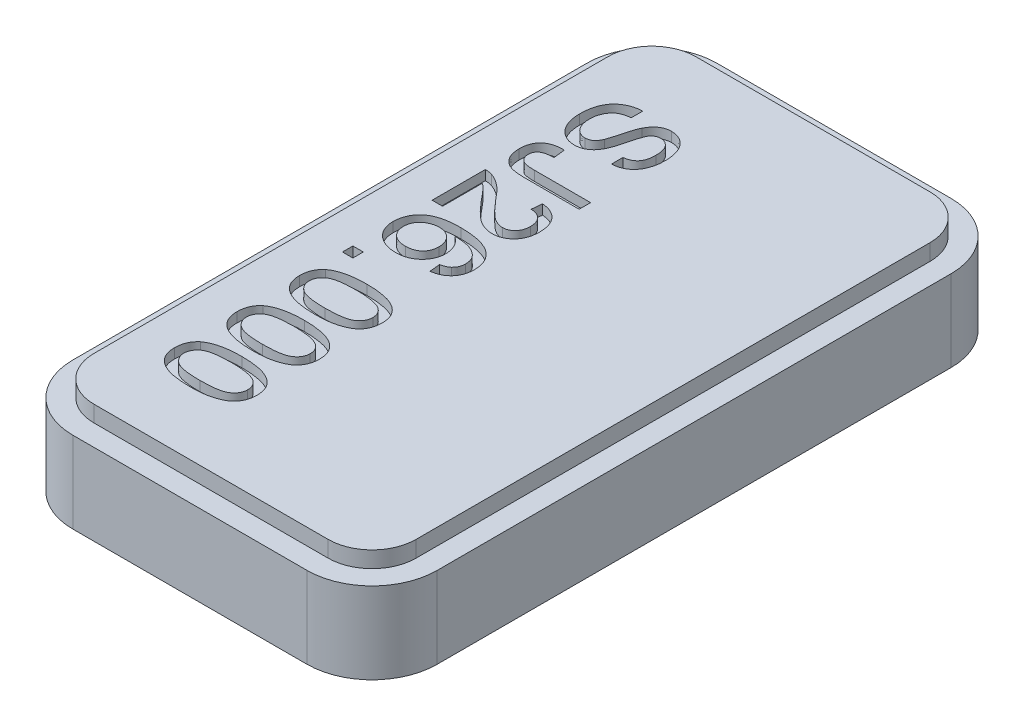
from build123d import *

# Parameters (mm, degrees)
BOSS_EXTRUDE1_DEPTH = 0.635
BOSS_EXTRUDE2_DEPTH = 0.127
SKETCH3_W           = 0.081410256
SKETCH3_H           = 0.081410256
CUT_EXTRUDE1_DEPTH  = 0.0762


with BuildPart() as part:
    # Sketch1 → Boss-Extrude1 (new body)
    with BuildSketch(Plane(origin=(0, 0, 0), x_dir=(1, 0, 0), z_dir=(0, 1, 0))):
        with BuildLine():
            Line((-0.9144, 2.5146), (0.9144, 2.5146))
            ThreePointArc((0.9144, 2.5146), (1.273610245, 2.365810245), (1.4224, 2.0066))
            Line((1.4224, 2.0066), (1.4224, -2.0066))
            ThreePointArc((1.4224, -2.0066), (1.273610245, -2.365810245), (0.9144, -2.5146))
            Line((0.9144, -2.5146), (-0.9144, -2.5146))
            ThreePointArc((-0.9144, -2.5146), (-1.273610245, -2.365810245), (-1.4224, -2.0066))
            Line((-1.4224, -2.0066), (-1.4224, 2.0066))
            ThreePointArc((-1.4224, 2.0066), (-1.273610245, 2.365810245), (-0.9144, 2.5146))
        make_face()
    extrude(amount=BOSS_EXTRUDE1_DEPTH)

    # Sketch2 → Boss-Extrude2 (add)
    with BuildSketch(Plane(origin=(0, 0.635, 0), x_dir=(1, 0, 0), z_dir=(0, 1, 0))):
        with BuildLine():
            Line((-0.9144, 2.3495), (0.9144, 2.3495))
            ThreePointArc((0.9144, 2.3495), (1.156866915, 2.249066915), (1.2573, 2.0066))
            Line((1.2573, 2.0066), (1.2573, -2.0066))
            ThreePointArc((1.2573, -2.0066), (1.156866915, -2.249066915), (0.9144, -2.3495))
            Line((0.9144, -2.3495), (-0.9144, -2.3495))
            ThreePointArc((-0.9144, -2.3495), (-1.156866915, -2.249066915), (-1.2573, -2.0066))
            Line((-1.2573, -2.0066), (-1.2573, 2.0066))
            ThreePointArc((-1.2573, 2.0066), (-1.156866915, 2.249066915), (-0.9144, 2.3495))
        make_face()
    extrude(amount=BOSS_EXTRUDE2_DEPTH)

    # Sketch3 → Cut-Extrude1 (cut)
    # profile 1 of 8: a face of its own
    with BuildSketch(Plane(origin=(0, 0.762, 0), x_dir=(1, 0, 0), z_dir=(0, 1, 0))):
        with BuildLine():
            Line((-0.753424195, 1.77419937), (-0.753424195, 1.684648088))
            add(Edge.make_bspline(
                [(-0.753424195, 1.684648088), (-0.761465428, 1.683664487), (-0.77691307, 1.681774938), (-0.798795669, 1.676465322), (-0.818531337, 1.669712754), (-0.836145432, 1.661012129), (-0.85184619, 1.650050373), (-0.865834799, 1.636561061), (-0.878059324, 1.620230531), (-0.888768656, 1.601730765), (-0.897376534, 1.581253363), (-0.903635748, 1.559357762), (-0.907378215, 1.536160188), (-0.907858461, 1.520272579), (-0.908103682, 1.512160107)],
                knots=[0, 0, 0, 0, 1.125661535, 2.162456423, 3.124646671, 4.021152204, 4.884793578, 5.777140414, 6.711097021, 7.712275503, 8.742730725, 9.791526725, 10.872317486, 12, 12, 12, 12], degree=3))
            add(Edge.make_bspline(
                [(-0.908103682, 1.512160107), (-0.907974474, 1.504981017), (-0.9077233, 1.491025185), (-0.904569176, 1.470784246), (-0.900201049, 1.451725051), (-0.893550475, 1.434195688), (-0.885311828, 1.418389387), (-0.875689223, 1.404491534), (-0.864440247, 1.392850612), (-0.851973105, 1.383477111), (-0.838747254, 1.376195628), (-0.825099494, 1.371120906), (-0.811299567, 1.36770386), (-0.801950678, 1.367332467), (-0.797309411, 1.367148088)],
                knots=[0, 0, 0, 0, 1.267278989, 2.463534024, 3.612003651, 4.716903637, 5.765847919, 6.755281273, 7.693132489, 8.613187884, 9.50174055, 10.350585091, 11.181146174, 12, 12, 12, 12], degree=3))
            add(Edge.make_bspline(
                [(-0.797309411, 1.367148088), (-0.792714401, 1.367344311), (-0.783724232, 1.367728223), (-0.770736874, 1.37071475), (-0.758696129, 1.375657404), (-0.747405304, 1.382455789), (-0.736980476, 1.391805983), (-0.727562824, 1.403746013), (-0.71877468, 1.418220108), (-0.71406796, 1.429071208), (-0.711574235, 1.434820364)],
                knots=[0, 0, 0, 0, 0.942390321, 1.843792698, 2.718029279, 3.604523015, 4.535311134, 5.574971969, 6.71516581, 8, 8, 8, 8], degree=3))
            add(Edge.make_bspline(
                [(-0.711574235, 1.434820364), (-0.710656157, 1.43705749), (-0.708582052, 1.442111566), (-0.705837069, 1.45077424), (-0.702283274, 1.461052425), (-0.69865447, 1.473160521), (-0.694713111, 1.487081279), (-0.690433677, 1.502782774), (-0.685699318, 1.520244651), (-0.68077696, 1.538965206), (-0.675736874, 1.557900939), (-0.670665257, 1.576025784), (-0.665594227, 1.592727675), (-0.660637812, 1.608096487), (-0.655691042, 1.622042887), (-0.650855316, 1.634638472), (-0.646233827, 1.645900496), (-0.642835567, 1.652778873), (-0.641230685, 1.656027295)],
                knots=[0, 0, 0, 0, 0.499203687, 1.127791816, 1.87544445, 2.745218927, 3.737540508, 4.863437871, 6.106074846, 7.473929386, 8.860961239, 10.152791525, 11.360569269, 12.465464948, 13.48744072, 14.416013254, 15.251937243, 16, 16, 16, 16], degree=3))
            add(Edge.make_bspline(
                [(-0.641230685, 1.656027295), (-0.637190668, 1.663498574), (-0.629392384, 1.677920088), (-0.615509121, 1.697343986), (-0.599955346, 1.7135718), (-0.583042344, 1.726827824), (-0.564814356, 1.737147003), (-0.545436237, 1.744344835), (-0.52506706, 1.749090135), (-0.511086053, 1.749545026), (-0.503978081, 1.749776293)],
                knots=[0, 0, 0, 0, 1.158753891, 2.236696577, 3.247844099, 4.216965963, 5.160353944, 6.094570301, 7.031275781, 8, 8, 8, 8], degree=3))
            add(Edge.make_bspline(
                [(-0.503978081, 1.749776293), (-0.496105261, 1.749474873), (-0.480446278, 1.74887535), (-0.457475622, 1.743531118), (-0.435320577, 1.735064474), (-0.417832333, 1.725221907), (-0.404531959, 1.715787486), (-0.39496785, 1.707962203), (-0.386178895, 1.699183349), (-0.377863084, 1.689834968), (-0.370345232, 1.679511738), (-0.363363643, 1.668534976), (-0.357107958, 1.656676466), (-0.349480911, 1.639887564), (-0.341661248, 1.617556853), (-0.334886337, 1.589440629), (-0.330920386, 1.559847153), (-0.330371281, 1.539647979), (-0.330090862, 1.529332583)],
                knots=[0, 0, 0, 0, 1.2001067, 2.387003517, 3.579163215, 4.810460134, 5.437089112, 6.066784591, 6.693680817, 7.331043701, 7.974292474, 8.640345033, 9.314862782, 10.018578828, 11.453312207, 12.917685044, 14.425910937, 16, 16, 16, 16], degree=3))
            add(Edge.make_bspline(
                [(-0.330090862, 1.529332583), (-0.330345906, 1.518041079), (-0.330841576, 1.49609639), (-0.335076583, 1.464159164), (-0.342218456, 1.434350608), (-0.350300088, 1.410946558), (-0.358455149, 1.393670923), (-0.364819817, 1.381398105), (-0.372178175, 1.370006471), (-0.380141086, 1.359393381), (-0.388705148, 1.349460912), (-0.398072837, 1.340461862), (-0.407929187, 1.332014866), (-0.422044212, 1.322064829), (-0.440869628, 1.311572547), (-0.464995315, 1.302011895), (-0.490685438, 1.295958146), (-0.508357, 1.294579323), (-0.517334451, 1.293878857)],
                knots=[0, 0, 0, 0, 1.607767564, 3.124646298, 4.577694013, 5.968230118, 6.64098443, 7.297468537, 7.935727887, 8.569831019, 9.186231226, 9.801209789, 10.418260488, 11.033239051, 12.257996117, 13.47812891, 14.718847046, 16, 16, 16, 16], degree=3))
            Line((-0.517334451, 1.293878857), (-0.517334451, 1.383430139))
            add(Edge.make_bspline(
                [(-0.517334451, 1.383430139), (-0.512782871, 1.383980402), (-0.503867618, 1.385058211), (-0.491055405, 1.388082811), (-0.479019112, 1.391697469), (-0.467903561, 1.396305348), (-0.457607426, 1.401748554), (-0.448333466, 1.408342476), (-0.439723618, 1.415569641), (-0.432015144, 1.423791573), (-0.425243929, 1.433023488), (-0.419378062, 1.443272066), (-0.414419505, 1.454534036), (-0.410359191, 1.466805279), (-0.407210731, 1.480086565), (-0.404894734, 1.494408581), (-0.403708592, 1.509765653), (-0.403478305, 1.520341835), (-0.403360092, 1.525770884)],
                knots=[0, 0, 0, 0, 1.074597235, 2.104830896, 3.08320792, 4.01963776, 4.922947153, 5.808618242, 6.683501764, 7.556007728, 8.44518997, 9.363001905, 10.32032511, 11.326760392, 12.390579697, 13.518793479, 14.726327422, 16, 16, 16, 16], degree=3))
            add(Edge.make_bspline(
                [(-0.403360092, 1.525770884), (-0.403402581, 1.531414147), (-0.403484829, 1.542338116), (-0.404986414, 1.558129631), (-0.407043572, 1.572767482), (-0.410088635, 1.586221385), (-0.414028212, 1.598427462), (-0.418684634, 1.60954837), (-0.424469354, 1.619352589), (-0.430943153, 1.628074325), (-0.43817599, 1.635553214), (-0.44558695, 1.642215739), (-0.453491678, 1.647712076), (-0.461628074, 1.652432427), (-0.470345204, 1.655760202), (-0.479264205, 1.658364728), (-0.488572899, 1.659950127), (-0.494898105, 1.660132117), (-0.498126719, 1.660225011)],
                knots=[0, 0, 0, 0, 1.464643987, 2.835190547, 4.115048982, 5.300866033, 6.411522794, 7.442255218, 8.424145068, 9.359957701, 10.255529779, 11.121374133, 11.943044406, 12.751479056, 13.556984722, 14.358492815, 15.162115312, 16, 16, 16, 16], degree=3))
            add(Edge.make_bspline(
                [(-0.498126719, 1.660225011), (-0.50358998, 1.659993589), (-0.514193666, 1.659544421), (-0.529258306, 1.65495776), (-0.542990703, 1.647903442), (-0.550462429, 1.640953815), (-0.554223474, 1.63745558)],
                knots=[0, 0, 0, 0, 1.050964922, 2.039826012, 3.013306874, 4, 4, 4, 4], degree=3))
            add(Edge.make_bspline(
                [(-0.554223474, 1.63745558), (-0.556103064, 1.63525033), (-0.560259662, 1.630373556), (-0.565760425, 1.621299564), (-0.571318288, 1.610049171), (-0.576843028, 1.59654714), (-0.582402868, 1.580816995), (-0.58812313, 1.562882787), (-0.593834326, 1.542642512), (-0.599246337, 1.520765541), (-0.604812486, 1.498698371), (-0.610265309, 1.477747005), (-0.615461924, 1.45847826), (-0.620525782, 1.440956293), (-0.62544834, 1.425164429), (-0.630331379, 1.411157211), (-0.63482259, 1.398821392), (-0.637982515, 1.391264244), (-0.639449836, 1.387755059)],
                knots=[0, 0, 0, 0, 0.523891657, 1.158554055, 1.913784378, 2.794767528, 3.797522645, 4.933640231, 6.202082727, 7.603978424, 9.013314845, 10.322177672, 11.523239011, 12.626145434, 13.623952425, 14.517289202, 15.3114987, 16, 16, 16, 16], degree=3))
            add(Edge.make_bspline(
                [(-0.639449836, 1.387755059), (-0.641554726, 1.383189307), (-0.645686272, 1.374227501), (-0.652743017, 1.361534007), (-0.660060817, 1.349681682), (-0.667901954, 1.338776038), (-0.676105063, 1.328753334), (-0.684763995, 1.319674576), (-0.693906116, 1.311595944), (-0.706448298, 1.302013174), (-0.723383479, 1.292187669), (-0.74526831, 1.283744208), (-0.768651141, 1.27846299), (-0.784773, 1.277889107), (-0.792984491, 1.277596806)],
                knots=[0, 0, 0, 0, 0.899337291, 1.765248388, 2.59684015, 3.3906421, 4.166844185, 4.912752363, 5.632941945, 6.347675468, 7.734877245, 9.118505574, 10.532342477, 12, 12, 12, 12], degree=3))
            add(Edge.make_bspline(
                [(-0.792984491, 1.277596806), (-0.801283377, 1.2779282), (-0.817759422, 1.278586129), (-0.842045875, 1.284251127), (-0.865579313, 1.293150541), (-0.884254392, 1.303587308), (-0.898519438, 1.313453207), (-0.908772502, 1.321741028), (-0.918253021, 1.330931745), (-0.927258003, 1.340799091), (-0.935603717, 1.351419678), (-0.943293005, 1.362883044), (-0.950405911, 1.375068198), (-0.959073404, 1.392468291), (-0.968140424, 1.415578506), (-0.975691132, 1.44501628), (-0.980589462, 1.476040128), (-0.981108154, 1.497343017), (-0.981372913, 1.508216798)],
                knots=[0, 0, 0, 0, 1.197055466, 2.376552968, 3.581957237, 4.820753935, 5.454298064, 6.085440993, 6.72202542, 7.359198513, 8.013298489, 8.67051481, 9.351020706, 10.049282741, 11.476266879, 12.925760103, 14.430794493, 16, 16, 16, 16], degree=3))
            add(Edge.make_bspline(
                [(-0.981372913, 1.508216798), (-0.981314101, 1.515130436), (-0.981198537, 1.528715588), (-0.979866111, 1.548617623), (-0.977880028, 1.567685129), (-0.974982561, 1.58586835), (-0.97112356, 1.603218539), (-0.96660647, 1.619715997), (-0.961233194, 1.63535924), (-0.955046865, 1.650140377), (-0.947809025, 1.664049643), (-0.940021551, 1.677325034), (-0.931123394, 1.689720705), (-0.921517177, 1.70140489), (-0.911012637, 1.712295667), (-0.899663162, 1.722326325), (-0.887533448, 1.731672747), (-0.874594628, 1.740155914), (-0.860999953, 1.747731393), (-0.846982095, 1.754544704), (-0.832438186, 1.76028481), (-0.817442045, 1.764910843), (-0.802093941, 1.768829312), (-0.786265845, 1.771546684), (-0.770007445, 1.773544586), (-0.758984596, 1.773979819), (-0.753424195, 1.77419937)],
                knots=[0, 0, 0, 0, 1.259794174, 2.475468585, 3.633483936, 4.752716887, 5.828920721, 6.87130154, 7.868357378, 8.841438305, 9.788394823, 10.72402761, 11.64389108, 12.56602382, 13.478685853, 14.398289622, 15.324106125, 16.267144882, 17.215109807, 18.158654996, 19.105737623, 20.061356657, 21.017194371, 21.990367343, 22.986254633, 24, 24, 24, 24], degree=3))
        make_face()
    # profile 2 of 8: a face of its own
    with BuildSketch(Plane(origin=(0, 0.762, 0), x_dir=(1, 0, 0), z_dir=(0, 1, 0))):
        with BuildLine():
            Line((-0.796037376, 1.204327575), (-0.785988298, 1.114776293))
            add(Edge.make_bspline(
                [(-0.785988298, 1.114776293), (-0.791631146, 1.114534341), (-0.802425767, 1.114071493), (-0.817922927, 1.112536974), (-0.832017972, 1.110394825), (-0.844762388, 1.107742115), (-0.85616499, 1.104651754), (-0.866133883, 1.100774425), (-0.87487819, 1.096598444), (-0.88212695, 1.091464446), (-0.888319483, 1.085958523), (-0.893586833, 1.079906475), (-0.898020134, 1.073394854), (-0.901831989, 1.066459394), (-0.904572701, 1.058888312), (-0.906584906, 1.050874857), (-0.907942347, 1.042358207), (-0.908048794, 1.036509203), (-0.908103682, 1.03349324)],
                knots=[0, 0, 0, 0, 1.63255286, 3.123030932, 4.49951906, 5.752042824, 6.885216223, 7.909610261, 8.841530719, 9.678034765, 10.467978015, 11.232499557, 11.990705893, 12.742044187, 13.51390061, 14.310662005, 15.128914839, 16, 16, 16, 16], degree=3))
            add(Edge.make_bspline(
                [(-0.908103682, 1.03349324), (-0.907956203, 1.029108544), (-0.907668029, 1.02054085), (-0.904731082, 1.008243324), (-0.900259283, 0.996782284), (-0.893929628, 0.986401451), (-0.885936593, 0.977337159), (-0.876729381, 0.969514975), (-0.865973371, 0.96361716), (-0.856131862, 0.959716878), (-0.847321175, 0.957387195), (-0.839642526, 0.956090951), (-0.831129568, 0.954761189), (-0.821655493, 0.953823994), (-0.811275994, 0.952846301), (-0.799939416, 0.952460015), (-0.787730244, 0.952007061), (-0.779289493, 0.951973268), (-0.774921591, 0.95195578)],
                knots=[0, 0, 0, 0, 1.177282391, 2.300408846, 3.380386581, 4.475609283, 5.550517805, 6.619299368, 7.707015968, 8.833610655, 9.458733008, 10.154353913, 10.926859838, 11.775644792, 12.714142741, 13.730089572, 14.82537164, 16, 16, 16, 16], degree=3))
            Line((-0.774921591, 0.95195578), (-0.338231887, 0.95195578))
            Line((-0.338231887, 0.95195578), (-0.338231887, 0.862404498))
            Line((-0.338231887, 0.862404498), (-0.769197432, 0.862404498))
            add(Edge.make_bspline(
                [(-0.769197432, 0.862404498), (-0.775643362, 0.862441193), (-0.788117938, 0.862512208), (-0.80628178, 0.863403409), (-0.823330907, 0.864961382), (-0.839309861, 0.866893614), (-0.854151113, 0.869628441), (-0.86789668, 0.872727897), (-0.88053494, 0.876524825), (-0.895641644, 0.882402926), (-0.912836351, 0.891343956), (-0.930875374, 0.905222009), (-0.946520102, 0.921652303), (-0.959222564, 0.940918816), (-0.969114717, 0.962402728), (-0.976212709, 0.985768439), (-0.980665811, 1.010893856), (-0.98113289, 1.028258684), (-0.981372913, 1.037182142)],
                knots=[0, 0, 0, 0, 0.979138624, 1.89489171, 2.761458997, 3.579560347, 4.338878061, 5.052915979, 5.71922422, 6.341219979, 7.513897407, 8.648873756, 9.783411367, 10.9446051, 12.137660755, 13.364187162, 14.645505386, 16, 16, 16, 16], degree=3))
            add(Edge.make_bspline(
                [(-0.981372913, 1.037182142), (-0.981226827, 1.043803524), (-0.980942269, 1.056701228), (-0.978726893, 1.075416717), (-0.975293561, 1.0930205), (-0.969950276, 1.109314378), (-0.963568893, 1.124590734), (-0.955472969, 1.138521307), (-0.94598287, 1.151270324), (-0.934983277, 1.162733339), (-0.922577582, 1.173031057), (-0.908623019, 1.181744515), (-0.89336433, 1.189259813), (-0.876564045, 1.194971611), (-0.858467434, 1.199642866), (-0.838856924, 1.202535523), (-0.817912114, 1.204434522), (-0.803462148, 1.204363875), (-0.796037376, 1.204327575)],
                knots=[0, 0, 0, 0, 1.110296574, 2.162732441, 3.157221742, 4.113121602, 5.033902568, 5.929283926, 6.808331651, 7.693657651, 8.587880195, 9.505359283, 10.446863844, 11.434309352, 12.476166735, 13.577612903, 14.755313945, 16, 16, 16, 16], degree=3))
        make_face()
    # profile 3 of 8: a face of its own
    with BuildSketch(Plane(origin=(0, 0.762, 0), x_dir=(1, 0, 0), z_dir=(0, 1, 0))):
        with BuildLine():
            Line((-0.891821631, 0.349519883), (-0.973231887, 0.349519883))
            Line((-0.973231887, 0.349519883), (-0.973231887, 0.764712191))
            add(Edge.make_bspline(
                [(-0.973231887, 0.764712191), (-0.968393447, 0.764720691), (-0.958732783, 0.764737662), (-0.944445275, 0.763102922), (-0.930347302, 0.760542592), (-0.921306833, 0.757647628), (-0.916753522, 0.756189554)],
                knots=[0, 0, 0, 0, 1.01057331, 2.01775941, 3.001627217, 4, 4, 4, 4], degree=3))
            add(Edge.make_bspline(
                [(-0.916753522, 0.756189554), (-0.909315574, 0.753492886), (-0.894170686, 0.748002025), (-0.87226871, 0.736920018), (-0.85062846, 0.723668541), (-0.83288364, 0.710986591), (-0.818810053, 0.699306499), (-0.80766633, 0.689674698), (-0.796402331, 0.678824668), (-0.784817207, 0.666954202), (-0.772910289, 0.654135338), (-0.760626091, 0.640368575), (-0.748198098, 0.625486124), (-0.739960126, 0.615096831), (-0.735742905, 0.609778296)],
                knots=[0, 0, 0, 0, 1.204749664, 2.453068735, 3.731868309, 5.069624937, 5.772016546, 6.5184395, 7.31363639, 8.154361805, 9.045869205, 9.979533915, 10.965673542, 12, 12, 12, 12], degree=3))
            add(Edge.make_bspline(
                [(-0.735742905, 0.609778296), (-0.728865833, 0.601607684), (-0.715623596, 0.585874652), (-0.695973342, 0.563657145), (-0.677726969, 0.543365069), (-0.66056467, 0.525321552), (-0.64465291, 0.509379017), (-0.630027739, 0.495500031), (-0.616734798, 0.483565174), (-0.60429294, 0.473720148), (-0.592544365, 0.465413598), (-0.581084355, 0.45837453), (-0.56971273, 0.452508401), (-0.558465472, 0.4476227), (-0.547294484, 0.443758526), (-0.536167218, 0.441124542), (-0.525194084, 0.439338265), (-0.517892439, 0.439159546), (-0.514281567, 0.439071165)],
                knots=[0, 0, 0, 0, 1.782554561, 3.432421876, 4.950675607, 6.337395053, 7.588547463, 8.709982106, 9.702713005, 10.569305638, 11.356701089, 12.103210377, 12.812277205, 13.490692607, 14.148717897, 14.782152033, 15.397739362, 16, 16, 16, 16], degree=3))
            add(Edge.make_bspline(
                [(-0.514281567, 0.439071165), (-0.510712825, 0.439159557), (-0.503711149, 0.439332977), (-0.493464239, 0.440978381), (-0.48359622, 0.443268914), (-0.47428474, 0.446972011), (-0.465254038, 0.451379807), (-0.456789518, 0.457033884), (-0.448680048, 0.463574434), (-0.441140105, 0.471063024), (-0.434064424, 0.479241506), (-0.428190195, 0.488382864), (-0.422854403, 0.497906834), (-0.418690525, 0.508128187), (-0.415481549, 0.518955888), (-0.413246009, 0.530372571), (-0.411800706, 0.542408718), (-0.411602495, 0.550624398), (-0.411501118, 0.554826373)],
                knots=[0, 0, 0, 0, 0.988220144, 1.938834179, 2.870816983, 3.789593262, 4.709270892, 5.651202005, 6.603702613, 7.592551374, 8.593130825, 9.593710277, 10.598146602, 11.615084639, 12.644976104, 13.72352976, 14.835681034, 16, 16, 16, 16], degree=3))
            add(Edge.make_bspline(
                [(-0.411501118, 0.554826373), (-0.411602668, 0.559240181), (-0.411801409, 0.567878328), (-0.413242945, 0.580506352), (-0.415458401, 0.59248934), (-0.418788378, 0.603784552), (-0.423147926, 0.614369402), (-0.428344059, 0.624318926), (-0.434502071, 0.63359508), (-0.441654335, 0.642049422), (-0.449445219, 0.649880772), (-0.458254167, 0.656496543), (-0.467617614, 0.662279631), (-0.477832834, 0.666841753), (-0.488675436, 0.670562307), (-0.500306376, 0.673247819), (-0.512675773, 0.674715573), (-0.521146984, 0.675010309), (-0.525475477, 0.675160908)],
                knots=[0, 0, 0, 0, 1.131353863, 2.214142649, 3.254522363, 4.251993147, 5.226998864, 6.184887163, 7.125534989, 8.07474883, 9.020220684, 9.950764588, 10.892228595, 11.83594911, 12.812226535, 13.827427868, 14.889891388, 16, 16, 16, 16], degree=3))
            Line((-0.525475477, 0.675160908), (-0.517334451, 0.756571165))
            add(Edge.make_bspline(
                [(-0.517334451, 0.756571165), (-0.510239286, 0.75573831), (-0.496436253, 0.754118062), (-0.47644592, 0.750080615), (-0.457845326, 0.744418385), (-0.440392924, 0.737622804), (-0.424302207, 0.729165954), (-0.409514477, 0.719361856), (-0.395962163, 0.708218152), (-0.383960439, 0.695540786), (-0.373005835, 0.681814981), (-0.363789181, 0.666700246), (-0.355803082, 0.650547221), (-0.349345584, 0.633240943), (-0.344397685, 0.614788204), (-0.340859909, 0.595217743), (-0.338676546, 0.574507407), (-0.338382222, 0.56030156), (-0.338231887, 0.553045524)],
                knots=[0, 0, 0, 0, 1.130902199, 2.200072888, 3.223843306, 4.206271996, 5.161246612, 6.096017809, 7.01151883, 7.932713564, 8.85544837, 9.78703152, 10.729845199, 11.705020675, 12.706647005, 13.750927778, 14.851223069, 16, 16, 16, 16], degree=3))
            add(Edge.make_bspline(
                [(-0.338231887, 0.553045524), (-0.338357669, 0.545702693), (-0.338602691, 0.531398815), (-0.341108306, 0.510555382), (-0.345013833, 0.490890464), (-0.350446465, 0.472325352), (-0.357621266, 0.454958683), (-0.366262656, 0.438730994), (-0.376519183, 0.42369367), (-0.388345976, 0.410050851), (-0.401262785, 0.397747898), (-0.415054288, 0.386981996), (-0.429608952, 0.377930972), (-0.444884741, 0.370444535), (-0.460980476, 0.364712101), (-0.477835809, 0.360722717), (-0.495409743, 0.357999521), (-0.507401897, 0.35777528), (-0.513518346, 0.357660908)],
                knots=[0, 0, 0, 0, 1.195163465, 2.32818547, 3.412777349, 4.456995471, 5.472468761, 6.467096601, 7.445683341, 8.429710765, 9.401551923, 10.346206623, 11.27346832, 12.187474603, 13.111233882, 14.049000595, 15.004916959, 16, 16, 16, 16], degree=3))
            add(Edge.make_bspline(
                [(-0.513518346, 0.357660908), (-0.519802946, 0.357832599), (-0.532386015, 0.358176358), (-0.551170177, 0.360960358), (-0.569807164, 0.365441754), (-0.588445086, 0.371660034), (-0.607100179, 0.38031391), (-0.626220401, 0.390971844), (-0.64566417, 0.404292813), (-0.662317314, 0.41692561), (-0.676179761, 0.428819719), (-0.687614373, 0.439362419), (-0.699811028, 0.451556702), (-0.713008509, 0.465078289), (-0.72701169, 0.480204127), (-0.742031583, 0.496658583), (-0.757750093, 0.514768471), (-0.768485762, 0.527342698), (-0.774031166, 0.533837791)],
                knots=[0, 0, 0, 0, 0.927016037, 1.85607784, 2.795426669, 3.753038224, 4.749807569, 5.825438141, 6.979408615, 8.224540393, 8.907917664, 9.673913905, 10.518929318, 11.452509573, 12.461825982, 13.560287397, 14.739790317, 16, 16, 16, 16], degree=3))
            add(Edge.make_bspline(
                [(-0.774031166, 0.533837791), (-0.778559042, 0.539399751), (-0.787193005, 0.550005552), (-0.799711287, 0.565093151), (-0.811185383, 0.578611222), (-0.821261529, 0.590857906), (-0.830341422, 0.60141825), (-0.838241066, 0.610518755), (-0.845071575, 0.618069056), (-0.855550478, 0.629579106), (-0.870362333, 0.644268071), (-0.884867818, 0.655004118), (-0.891821631, 0.660150892)],
                knots=[0, 0, 0, 0, 1.24205232, 2.36840259, 3.395101816, 4.312728136, 5.114777656, 5.806942724, 6.399692637, 6.87784234, 8.503262741, 10, 10, 10, 10], degree=3))
            Line((-0.891821631, 0.660150892), (-0.891821631, 0.349519883))
        make_face()
    # profile 4 of 8: a face of its own
    with BuildSketch(Plane(origin=(0, 0.762, 0), x_dir=(1, 0, 0), z_dir=(0, 1, 0))):
        with BuildLine():
            Line((-0.5010524, -0.138941656), (-0.509193426, -0.057531399))
            add(Edge.make_bspline(
                [(-0.509193426, -0.057531399), (-0.502191709, -0.055774631), (-0.489012056, -0.052467786), (-0.471135844, -0.045533363), (-0.45601561, -0.037891777), (-0.447873781, -0.031252899), (-0.444065221, -0.028147385)],
                knots=[0, 0, 0, 0, 1.199207122, 2.257322842, 3.184815751, 4, 4, 4, 4], degree=3))
            add(Edge.make_bspline(
                [(-0.444065221, -0.028147385), (-0.441467574, -0.025481662), (-0.436358603, -0.020238803), (-0.429699023, -0.011631936), (-0.424056694, -0.002558873), (-0.419485551, 0.007007807), (-0.415874611, 0.017016422), (-0.413348566, 0.027508429), (-0.411784801, 0.03846006), (-0.411596484, 0.045922228), (-0.411501118, 0.049701173)],
                knots=[0, 0, 0, 0, 1.028360939, 2.022547923, 3.001693811, 3.976902288, 4.948369586, 5.937776631, 6.955661634, 8, 8, 8, 8], degree=3))
            add(Edge.make_bspline(
                [(-0.411501118, 0.049701173), (-0.411698378, 0.055827493), (-0.412088155, 0.067932834), (-0.415904042, 0.085693532), (-0.421615125, 0.102944163), (-0.427404486, 0.113631567), (-0.43032724, 0.119027094)],
                knots=[0, 0, 0, 0, 1.010336883, 1.996381556, 2.988474728, 4, 4, 4, 4], degree=3))
            add(Edge.make_bspline(
                [(-0.43032724, 0.119027094), (-0.434725111, 0.124330817), (-0.443752889, 0.13521809), (-0.460384796, 0.149457365), (-0.479884737, 0.161994296), (-0.497955041, 0.171424224), (-0.514239957, 0.177964455), (-0.528115997, 0.182436137), (-0.543535084, 0.186024354), (-0.560347148, 0.189079713), (-0.578610948, 0.191423334), (-0.598328292, 0.193388303), (-0.619552098, 0.194473722), (-0.634191035, 0.194715648), (-0.641739499, 0.194840396)],
                knots=[0, 0, 0, 0, 1.063450586, 2.183009608, 3.366294357, 4.641264713, 5.326401404, 6.07664488, 6.892063598, 7.77129542, 8.7166684, 9.737191916, 10.833199044, 12, 12, 12, 12], degree=3))
            add(Edge.make_bspline(
                [(-0.641739499, 0.194840396), (-0.634998127, 0.190039118), (-0.62180148, 0.180640325), (-0.604481578, 0.164065204), (-0.589973064, 0.145854062), (-0.57826799, 0.126207277), (-0.569274795, 0.105558884), (-0.5627236, 0.084367562), (-0.558759564, 0.062612389), (-0.558280795, 0.047936547), (-0.55803958, 0.040542519)],
                knots=[0, 0, 0, 0, 1.084049016, 2.12209208, 3.130949879, 4.128207417, 5.11149915, 6.076901555, 7.031098562, 8, 8, 8, 8], degree=3))
            add(Edge.make_bspline(
                [(-0.55803958, 0.040542519), (-0.558210405, 0.034173904), (-0.558547903, 0.021591495), (-0.561238013, 0.00306605), (-0.565892311, -0.014669709), (-0.572101247, -0.031780898), (-0.580341068, -0.048041109), (-0.590142785, -0.063726337), (-0.602004702, -0.078488168), (-0.615343669, -0.092524127), (-0.630170663, -0.105304531), (-0.646129515, -0.116615775), (-0.66325754, -0.126041919), (-0.681440279, -0.133685411), (-0.700611502, -0.139667784), (-0.720825667, -0.144014687), (-0.742122722, -0.146559307), (-0.756682241, -0.146905886), (-0.764109291, -0.147082681)],
                knots=[0, 0, 0, 0, 0.981571796, 1.939281725, 2.877861438, 3.804367779, 4.739823863, 5.68285443, 6.650639019, 7.653910388, 8.664247958, 9.663507932, 10.664113941, 11.671783641, 12.699293534, 13.755733966, 14.85516306, 16, 16, 16, 16], degree=3))
            add(Edge.make_bspline(
                [(-0.764109291, -0.147082681), (-0.773923871, -0.14676421), (-0.793292708, -0.146135714), (-0.821830518, -0.141143099), (-0.849264435, -0.132969399), (-0.871185447, -0.123590158), (-0.887697162, -0.11443633), (-0.899478666, -0.107084455), (-0.910441676, -0.098994549), (-0.920783795, -0.0904309), (-0.930162525, -0.081020103), (-0.939040523, -0.07130196), (-0.946900006, -0.060736753), (-0.954188088, -0.049752707), (-0.960492831, -0.038125254), (-0.966137678, -0.026178849), (-0.970855612, -0.013802649), (-0.974639285, -0.001029794), (-0.977736942, 0.012082421), (-0.979872442, 0.025602458), (-0.98118805, 0.039498329), (-0.981310815, 0.048892589), (-0.981372913, 0.053644482)],
                knots=[0, 0, 0, 0, 1.777725645, 3.508298892, 5.231915806, 6.956149154, 7.815891424, 8.651536337, 9.470662572, 10.283276216, 11.081966684, 11.876395462, 12.66627801, 13.465448804, 14.263251756, 15.060721634, 15.858413576, 16.660607494, 17.473221138, 18.298093177, 19.139125428, 20, 20, 20, 20], degree=3))
            add(Edge.make_bspline(
                [(-0.981372913, 0.053644482), (-0.981149817, 0.061669334), (-0.980712287, 0.07740748), (-0.977367223, 0.100446397), (-0.971725488, 0.122346724), (-0.963989177, 0.143146606), (-0.953991182, 0.162801101), (-0.941641977, 0.181242039), (-0.927094376, 0.198548784), (-0.910340963, 0.214745792), (-0.89093877, 0.22937758), (-0.868707146, 0.242133172), (-0.843461534, 0.252581321), (-0.815516988, 0.261406052), (-0.784609146, 0.267939691), (-0.750937652, 0.27297855), (-0.714372732, 0.275628849), (-0.689062898, 0.27603852), (-0.675957248, 0.276250652)],
                knots=[0, 0, 0, 0, 0.898449204, 1.762016875, 2.600428026, 3.426826527, 4.242280324, 5.064055083, 5.906691075, 6.769749479, 7.668135943, 8.621070442, 9.631748766, 10.722023185, 11.898351526, 13.165512303, 14.532277789, 16, 16, 16, 16], degree=3))
            add(Edge.make_bspline(
                [(-0.675957248, 0.276250652), (-0.668494191, 0.276199478), (-0.653776101, 0.276098556), (-0.632096366, 0.275371679), (-0.611188458, 0.273938445), (-0.591079639, 0.272054578), (-0.57173772, 0.269627308), (-0.553175235, 0.266778088), (-0.535418165, 0.263142901), (-0.518427283, 0.259143141), (-0.502190921, 0.254503119), (-0.486688601, 0.249516847), (-0.472033903, 0.243729812), (-0.45813804, 0.237518627), (-0.445021373, 0.230759804), (-0.432633483, 0.223564356), (-0.421133278, 0.215610399), (-0.413930091, 0.209890044), (-0.410356286, 0.207051934)],
                knots=[0, 0, 0, 0, 1.280444348, 2.525197649, 3.720942618, 4.875526429, 5.989898656, 7.065115415, 8.096622082, 9.098853712, 10.059152529, 10.993162051, 11.891531392, 12.760921141, 13.603603485, 14.422073071, 15.217123906, 16, 16, 16, 16], degree=3))
            add(Edge.make_bspline(
                [(-0.410356286, 0.207051934), (-0.404588124, 0.20192378), (-0.393218539, 0.191815713), (-0.378531729, 0.174523989), (-0.365986934, 0.156098199), (-0.355851826, 0.136244476), (-0.34795017, 0.115114563), (-0.342214268, 0.092695212), (-0.338887841, 0.068923864), (-0.338454082, 0.052679759), (-0.338231887, 0.044358625)],
                knots=[0, 0, 0, 0, 1.005002357, 1.980952959, 2.948226316, 3.90482984, 4.879026092, 5.883055346, 6.915583142, 8, 8, 8, 8], degree=3))
            add(Edge.make_bspline(
                [(-0.338231887, 0.044358625), (-0.338341414, 0.038162616), (-0.338556587, 0.025990059), (-0.340621196, 0.008154155), (-0.34407188, -0.008810924), (-0.348726467, -0.024942964), (-0.354922316, -0.04014816), (-0.362265069, -0.054601811), (-0.371097939, -0.068157152), (-0.381300249, -0.080716049), (-0.392582792, -0.092309609), (-0.405040314, -0.1026938), (-0.41851755, -0.111829494), (-0.43304253, -0.119788134), (-0.448546498, -0.126498602), (-0.465096089, -0.13200823), (-0.482687048, -0.136195915), (-0.49484576, -0.138013722), (-0.5010524, -0.138941656)],
                knots=[0, 0, 0, 0, 1.095988384, 2.15315746, 3.171326302, 4.156539379, 5.119213808, 6.072133135, 7.021027441, 7.975952916, 8.930907862, 9.879001051, 10.840359051, 11.807350428, 12.805278655, 13.825435679, 14.889953203, 16, 16, 16, 16], degree=3))
        make_face()
        with BuildLine():
            add(Edge.make_bspline(
                [(-0.762455645, 0.194840396), (-0.768830031, 0.194613956), (-0.78149512, 0.19416405), (-0.800294271, 0.190722782), (-0.818636271, 0.185102948), (-0.836317413, 0.177400901), (-0.852744988, 0.167890292), (-0.867300953, 0.156593905), (-0.87977159, 0.143756939), (-0.890183961, 0.129448384), (-0.898185581, 0.113701826), (-0.903980834, 0.096799289), (-0.907483504, 0.078720579), (-0.907893834, 0.066253368), (-0.908103682, 0.059877455)],
                knots=[0, 0, 0, 0, 1.034121613, 2.054667162, 3.090870403, 4.141799978, 5.178094622, 6.163726224, 7.122467907, 8.07367165, 9.024701118, 9.977919151, 10.965878387, 12, 12, 12, 12], degree=3))
            add(Edge.make_bspline(
                [(-0.908103682, 0.059877455), (-0.907981355, 0.055333677), (-0.907742583, 0.046464625), (-0.905876228, 0.033482509), (-0.903055434, 0.021121252), (-0.898738168, 0.009438883), (-0.893453338, -0.001645963), (-0.886847651, -0.012078097), (-0.87910628, -0.021860356), (-0.870180487, -0.030887201), (-0.860256143, -0.03904659), (-0.849390944, -0.046135733), (-0.837764524, -0.052396187), (-0.825090929, -0.057105029), (-0.811694908, -0.060942059), (-0.79744978, -0.063763007), (-0.782339194, -0.065419201), (-0.771957694, -0.065586794), (-0.766653362, -0.065672425)],
                knots=[0, 0, 0, 0, 1.023462019, 1.997707343, 2.950204755, 3.875082018, 4.798131411, 5.712685617, 6.65128003, 7.603921197, 8.567945975, 9.540503156, 10.523517238, 11.53671457, 12.580096959, 13.661292135, 14.805058716, 16, 16, 16, 16], degree=3))
            add(Edge.make_bspline(
                [(-0.766653362, -0.065672425), (-0.761559729, -0.065592928), (-0.751598487, -0.065437463), (-0.737062244, -0.063690873), (-0.723322861, -0.061141212), (-0.710484476, -0.057246066), (-0.698470316, -0.05240995), (-0.687203725, -0.046581328), (-0.676821018, -0.039543221), (-0.667434048, -0.031345672), (-0.658897755, -0.022359487), (-0.6514292, -0.012483823), (-0.645238997, -0.001769901), (-0.640064822, 0.00967501), (-0.63613985, 0.021931076), (-0.633412225, 0.034979807), (-0.631510352, 0.048755207), (-0.631377021, 0.058217018), (-0.63130881, 0.063057543)],
                knots=[0, 0, 0, 0, 1.155383407, 2.259498055, 3.31823029, 4.322885379, 5.298549415, 6.25407473, 7.196229935, 8.137696897, 9.077096105, 10.004740892, 10.940535275, 11.8794908, 12.850254721, 13.854356636, 14.902319961, 16, 16, 16, 16], degree=3))
            add(Edge.make_bspline(
                [(-0.63130881, 0.063057543), (-0.631379095, 0.067559294), (-0.631517599, 0.076430422), (-0.633435658, 0.089439462), (-0.636163883, 0.101979631), (-0.640146805, 0.113991025), (-0.645212045, 0.125480378), (-0.651566021, 0.136377823), (-0.658896476, 0.146830633), (-0.667452426, 0.156557767), (-0.676725944, 0.165562808), (-0.686886689, 0.173406262), (-0.697741903, 0.180010088), (-0.709287235, 0.185596508), (-0.721612174, 0.189726209), (-0.734614592, 0.19265273), (-0.748284923, 0.194470055), (-0.75765858, 0.194715028), (-0.762455645, 0.194840396)],
                knots=[0, 0, 0, 0, 1.037172838, 2.043847658, 3.025909439, 3.99370322, 4.956694024, 5.916004533, 6.898066313, 7.896061507, 8.898787354, 9.874696845, 10.848988603, 11.824261125, 12.826080801, 13.838909816, 14.894039933, 16, 16, 16, 16], degree=3))
        make_face(mode=Mode.SUBTRACT)
    # profile 5 of 8: a face of its own
    with BuildSketch(Plane(origin=(0, 0.762, 0), x_dir=(1, 0, 0), z_dir=(0, 1, 0))):
        with Locations((-0.932526759, -0.309903194)):
            Rectangle(SKETCH3_W, SKETCH3_H)
    # profile 6 of 8: a face of its own
    with BuildSketch(Plane(origin=(0, 0.762, 0), x_dir=(1, 0, 0), z_dir=(0, 1, 0))):
        with BuildLine():
            add(Edge.make_bspline(
                [(-0.660056807, -0.472723707), (-0.650982074, -0.472805728), (-0.633208494, -0.472966372), (-0.607202553, -0.473962796), (-0.582505789, -0.475702475), (-0.559139642, -0.478299323), (-0.537051403, -0.481374523), (-0.516272477, -0.485372144), (-0.496756645, -0.489870571), (-0.478522866, -0.495266047), (-0.461419161, -0.501200113), (-0.445456288, -0.507910702), (-0.430728667, -0.51552738), (-0.416836339, -0.523363323), (-0.404430057, -0.532486365), (-0.392724009, -0.541738227), (-0.382386402, -0.552065148), (-0.373078862, -0.562975973), (-0.364868091, -0.574651529), (-0.35778251, -0.587024754), (-0.351526639, -0.600049446), (-0.346817176, -0.61397346), (-0.342977978, -0.628507839), (-0.340153814, -0.643764433), (-0.338488875, -0.659760062), (-0.338318518, -0.670690826), (-0.338231887, -0.676249348)],
                knots=[0, 0, 0, 0, 1.514715004, 2.966688829, 4.343277319, 5.646155648, 6.890271291, 8.064567311, 9.176982507, 10.231801866, 11.236819303, 12.197732759, 13.118802951, 14.00370591, 14.856056722, 15.686168072, 16.491905873, 17.290274347, 18.077650358, 18.870352107, 19.668187111, 20.485160842, 21.319455353, 22.17593919, 23.072426909, 24, 24, 24, 24], degree=3))
            add(Edge.make_bspline(
                [(-0.338231887, -0.676249348), (-0.338471855, -0.684404277), (-0.338943281, -0.700424962), (-0.342781676, -0.723817733), (-0.34936408, -0.745854443), (-0.358174722, -0.766531642), (-0.369571983, -0.785402229), (-0.383070708, -0.802462994), (-0.39923606, -0.817024609), (-0.417537546, -0.829568081), (-0.438011494, -0.840324109), (-0.460465099, -0.849945816), (-0.484993542, -0.858572573), (-0.506887736, -0.864886984), (-0.525819595, -0.869313945), (-0.54146358, -0.872009203), (-0.558291706, -0.874497708), (-0.576344272, -0.876261594), (-0.595536904, -0.878056491), (-0.61595329, -0.878942654), (-0.637579568, -0.879618926), (-0.652423935, -0.879721993), (-0.660056807, -0.879774989)],
                knots=[0, 0, 0, 0, 1.134508601, 2.228787654, 3.287419779, 4.328790846, 5.347871456, 6.346850563, 7.345149742, 8.363256079, 9.427154287, 10.558404831, 11.760335901, 13.043439251, 13.7276639, 14.464993199, 15.251939769, 16.09452972, 16.988861801, 17.934185368, 18.937772297, 20, 20, 20, 20], degree=3))
            add(Edge.make_bspline(
                [(-0.660056807, -0.879774989), (-0.669088986, -0.879691894), (-0.686735125, -0.879529552), (-0.712531552, -0.878553403), (-0.737045479, -0.876731513), (-0.760306801, -0.874383741), (-0.782337088, -0.871222762), (-0.803082426, -0.867271903), (-0.822568259, -0.862708654), (-0.84081424, -0.857544714), (-0.85784548, -0.851536844), (-0.873743486, -0.844760761), (-0.888664036, -0.837494798), (-0.902329246, -0.829253222), (-0.914965329, -0.820475454), (-0.926612064, -0.811079486), (-0.937103919, -0.800870697), (-0.94638088, -0.789858028), (-0.954739302, -0.77826582), (-0.961889311, -0.765860439), (-0.967854211, -0.752670909), (-0.972839608, -0.738814778), (-0.976628407, -0.724200079), (-0.979441489, -0.708902959), (-0.981121711, -0.69282362), (-0.981288024, -0.68185033), (-0.981372913, -0.676249348)],
                knots=[0, 0, 0, 0, 1.50892112, 2.947974422, 4.311604492, 5.614840882, 6.853004102, 8.028299315, 9.14166105, 10.195403725, 11.194594867, 12.156325951, 13.08133133, 13.964490992, 14.819271038, 15.650088719, 16.461567135, 17.260614929, 18.05275699, 18.846133239, 19.648095618, 20.468123593, 21.303127994, 22.167306962, 23.06455749, 24, 24, 24, 24], degree=3))
            add(Edge.make_bspline(
                [(-0.981372913, -0.676249348), (-0.981163443, -0.668905975), (-0.980755034, -0.65458842), (-0.977980146, -0.633678687), (-0.973096213, -0.614053787), (-0.966546171, -0.595548195), (-0.957785112, -0.57836992), (-0.947125573, -0.562436941), (-0.93481556, -0.547429098), (-0.925103242, -0.538789671), (-0.920188017, -0.534417417)],
                knots=[0, 0, 0, 0, 1.10322584, 2.150986741, 3.161425019, 4.136713905, 5.093944212, 6.049774532, 7.013026876, 8, 8, 8, 8], degree=3))
            add(Edge.make_bspline(
                [(-0.920188017, -0.534417417), (-0.912928468, -0.529384851), (-0.897958966, -0.519007486), (-0.872434576, -0.506861679), (-0.844335807, -0.496027405), (-0.813111363, -0.487524486), (-0.779009757, -0.48086458), (-0.741964073, -0.476054466), (-0.701990317, -0.473332415), (-0.674350185, -0.47293119), (-0.660056807, -0.472723707)],
                knots=[0, 0, 0, 0, 0.779365345, 1.607084704, 2.489375761, 3.438383567, 4.461919411, 5.557722155, 6.737039282, 8, 8, 8, 8], degree=3))
        make_face()
        with BuildLine():
            add(Edge.make_bspline(
                [(-0.6598024, -0.554133963), (-0.67201576, -0.554214797), (-0.695394832, -0.554369531), (-0.728795869, -0.555986126), (-0.758928165, -0.558769027), (-0.785749997, -0.562448204), (-0.809297649, -0.567306207), (-0.829511114, -0.573406004), (-0.846632998, -0.580281927), (-0.86045109, -0.588790751), (-0.871714851, -0.598106973), (-0.88140205, -0.607725336), (-0.889635947, -0.617872126), (-0.896501337, -0.628481137), (-0.90169936, -0.639716975), (-0.905466899, -0.651456779), (-0.907635059, -0.663703102), (-0.907946583, -0.672043404), (-0.908103682, -0.676249348)],
                knots=[0, 0, 0, 0, 1.89448813, 3.626469325, 5.185477471, 6.587276848, 7.82441448, 8.910550357, 9.859733512, 10.6775885, 11.416198291, 12.123144072, 12.791880183, 13.439617036, 14.078171869, 14.70637855, 15.347637704, 16, 16, 16, 16], degree=3))
            add(Edge.make_bspline(
                [(-0.908103682, -0.676249348), (-0.907943151, -0.680454238), (-0.90762482, -0.688792452), (-0.905504469, -0.701067072), (-0.901542981, -0.712761198), (-0.896363317, -0.723980284), (-0.889654409, -0.734666404), (-0.881389411, -0.744763361), (-0.871707964, -0.754432391), (-0.860313283, -0.763706765), (-0.846431305, -0.772150764), (-0.829323368, -0.77915567), (-0.809074504, -0.785160406), (-0.785538849, -0.790045066), (-0.758759424, -0.79373942), (-0.728710702, -0.796505495), (-0.69535264, -0.798132908), (-0.672015815, -0.798285088), (-0.6598024, -0.798364733)],
                knots=[0, 0, 0, 0, 0.652509534, 1.29391342, 1.924290653, 2.562989607, 3.207355802, 3.876242846, 4.583348185, 5.32723334, 6.150888545, 7.094226006, 8.186903555, 9.424320409, 10.81992305, 12.379283064, 14.105084285, 16, 16, 16, 16], degree=3))
            add(Edge.make_bspline(
                [(-0.6598024, -0.798364733), (-0.647843106, -0.798287639), (-0.624929551, -0.798139932), (-0.592171998, -0.796470533), (-0.562545419, -0.793854496), (-0.536022733, -0.790275982), (-0.512631997, -0.785520741), (-0.492325715, -0.779751454), (-0.475140106, -0.772882085), (-0.460924428, -0.764697183), (-0.449189857, -0.755622027), (-0.439230647, -0.745979906), (-0.430503058, -0.735957415), (-0.423669175, -0.724981812), (-0.418064406, -0.713519685), (-0.414312391, -0.701325323), (-0.411904377, -0.68855618), (-0.411637504, -0.679822351), (-0.411501118, -0.675358923)],
                knots=[0, 0, 0, 0, 1.850145643, 3.544809038, 5.072983816, 6.450691362, 7.683229814, 8.76276662, 9.712991103, 10.538891656, 11.292051756, 12.001912283, 12.681449089, 13.342071824, 13.996410874, 14.649960216, 15.310061595, 16, 16, 16, 16], degree=3))
            add(Edge.make_bspline(
                [(-0.411501118, -0.675358923), (-0.411611501, -0.671153244), (-0.411829161, -0.662860183), (-0.413906724, -0.650718055), (-0.417380874, -0.639211104), (-0.422086946, -0.628207496), (-0.428420391, -0.61798193), (-0.435815138, -0.608128887), (-0.444824812, -0.599109844), (-0.451560303, -0.593675048), (-0.455004724, -0.590895782)],
                knots=[0, 0, 0, 0, 1.021318143, 2.013908504, 2.982026795, 3.937174072, 4.91255697, 5.897578595, 6.924855925, 8, 8, 8, 8], degree=3))
            add(Edge.make_bspline(
                [(-0.455004724, -0.590895782), (-0.460063511, -0.587870009), (-0.470746604, -0.581480214), (-0.48931426, -0.574330404), (-0.510533557, -0.568014545), (-0.534730969, -0.562814499), (-0.561864987, -0.55905263), (-0.5919041, -0.556082781), (-0.624890248, -0.554540054), (-0.647843937, -0.554273062), (-0.6598024, -0.554133963)],
                knots=[0, 0, 0, 0, 0.671104906, 1.417232262, 2.260109084, 3.195198885, 4.23592645, 5.382417421, 6.636286093, 8, 8, 8, 8], degree=3))
        make_face(mode=Mode.SUBTRACT)
    # profile 7 of 8: a face of its own
    with BuildSketch(Plane(origin=(0, 0.762, 0), x_dir=(1, 0, 0), z_dir=(0, 1, 0))):
        with BuildLine():
            add(Edge.make_bspline(
                [(-0.660056807, -0.961185245), (-0.650982074, -0.961267266), (-0.633208494, -0.961427911), (-0.607202553, -0.962424334), (-0.582505789, -0.964164013), (-0.559139642, -0.966760862), (-0.537051403, -0.969836061), (-0.516272477, -0.973833682), (-0.496756645, -0.978332109), (-0.478522866, -0.983727585), (-0.461419161, -0.989661651), (-0.445456288, -0.99637224), (-0.430728667, -1.003988919), (-0.416836339, -1.011824862), (-0.404430057, -1.020947904), (-0.392724009, -1.030199766), (-0.382386402, -1.040526687), (-0.373078862, -1.051437512), (-0.364868091, -1.063113067), (-0.35778251, -1.075486293), (-0.351526639, -1.088510985), (-0.346817176, -1.102434998), (-0.342977978, -1.116969377), (-0.340153814, -1.132225971), (-0.338488875, -1.148221601), (-0.338318518, -1.159152364), (-0.338231887, -1.164710886)],
                knots=[0, 0, 0, 0, 1.514715004, 2.966688829, 4.343277319, 5.646155648, 6.890271291, 8.064567311, 9.176982507, 10.231801866, 11.236819303, 12.197732759, 13.118802951, 14.00370591, 14.856056722, 15.686168072, 16.491905873, 17.290274347, 18.077650358, 18.870352107, 19.668187111, 20.485160842, 21.319455353, 22.17593919, 23.072426909, 24, 24, 24, 24], degree=3))
            add(Edge.make_bspline(
                [(-0.338231887, -1.164710886), (-0.338471855, -1.172865815), (-0.338943281, -1.1888865), (-0.342781676, -1.212279272), (-0.34936408, -1.234315981), (-0.358174722, -1.254993181), (-0.369571983, -1.273863767), (-0.383070708, -1.290924532), (-0.39923606, -1.305486147), (-0.417537546, -1.31802962), (-0.438011494, -1.328785647), (-0.460465099, -1.338407355), (-0.484993542, -1.347034111), (-0.506887736, -1.353348522), (-0.525819595, -1.357775483), (-0.54146358, -1.360470742), (-0.558291706, -1.362959246), (-0.576344272, -1.364723132), (-0.595536904, -1.366518029), (-0.61595329, -1.367404192), (-0.637579568, -1.368080465), (-0.652423935, -1.368183531), (-0.660056807, -1.368236527)],
                knots=[0, 0, 0, 0, 1.134508601, 2.228787654, 3.287419779, 4.328790846, 5.347871456, 6.346850563, 7.345149742, 8.363256079, 9.427154287, 10.558404831, 11.760335901, 13.043439251, 13.7276639, 14.464993199, 15.251939769, 16.09452972, 16.988861801, 17.934185368, 18.937772297, 20, 20, 20, 20], degree=3))
            add(Edge.make_bspline(
                [(-0.660056807, -1.368236527), (-0.669088986, -1.368153433), (-0.686735125, -1.367991091), (-0.712531552, -1.367014942), (-0.737045479, -1.365193051), (-0.760306801, -1.362845279), (-0.782337088, -1.3596843), (-0.803082426, -1.355733442), (-0.822568259, -1.351170193), (-0.84081424, -1.346006252), (-0.85784548, -1.339998383), (-0.873743486, -1.3332223), (-0.888664036, -1.325956337), (-0.902329246, -1.31771476), (-0.914965329, -1.308936992), (-0.926612064, -1.299541024), (-0.937103919, -1.289332236), (-0.94638088, -1.278319566), (-0.954739302, -1.266727358), (-0.961889311, -1.254321978), (-0.967854211, -1.241132447), (-0.972839608, -1.227276317), (-0.976628407, -1.212661617), (-0.979441489, -1.197364497), (-0.981121711, -1.181285158), (-0.981288024, -1.170311869), (-0.981372913, -1.164710886)],
                knots=[0, 0, 0, 0, 1.50892112, 2.947974422, 4.311604492, 5.614840882, 6.853004102, 8.028299315, 9.14166105, 10.195403725, 11.194594867, 12.156325951, 13.08133133, 13.964490992, 14.819271038, 15.650088719, 16.461567135, 17.260614929, 18.05275699, 18.846133239, 19.648095618, 20.468123593, 21.303127994, 22.167306962, 23.06455749, 24, 24, 24, 24], degree=3))
            add(Edge.make_bspline(
                [(-0.981372913, -1.164710886), (-0.981163443, -1.157367514), (-0.980755034, -1.143049959), (-0.977980146, -1.122140225), (-0.973096213, -1.102515325), (-0.966546171, -1.084009733), (-0.957785112, -1.066831458), (-0.947125573, -1.05089848), (-0.93481556, -1.035890637), (-0.925103242, -1.02725121), (-0.920188017, -1.022878955)],
                knots=[0, 0, 0, 0, 1.10322584, 2.150986741, 3.161425019, 4.136713905, 5.093944212, 6.049774532, 7.013026876, 8, 8, 8, 8], degree=3))
            add(Edge.make_bspline(
                [(-0.920188017, -1.022878955), (-0.912928468, -1.01784639), (-0.897958966, -1.007469024), (-0.872434576, -0.995323218), (-0.844335807, -0.984488943), (-0.813111363, -0.975986024), (-0.779009757, -0.969326119), (-0.741964073, -0.964516004), (-0.701990317, -0.961793953), (-0.674350185, -0.961392728), (-0.660056807, -0.961185245)],
                knots=[0, 0, 0, 0, 0.779365345, 1.607084704, 2.489375761, 3.438383567, 4.461919411, 5.557722155, 6.737039282, 8, 8, 8, 8], degree=3))
        make_face()
        with BuildLine():
            add(Edge.make_bspline(
                [(-0.6598024, -1.042595502), (-0.67201576, -1.042676336), (-0.695394832, -1.04283107), (-0.728795869, -1.044447664), (-0.758928165, -1.047230565), (-0.785749997, -1.050909742), (-0.809297649, -1.055767745), (-0.829511114, -1.061867543), (-0.846632998, -1.068743465), (-0.86045109, -1.077252289), (-0.871714851, -1.086568511), (-0.88140205, -1.096186874), (-0.889635947, -1.106333664), (-0.896501337, -1.116942675), (-0.90169936, -1.128178514), (-0.905466899, -1.139918317), (-0.907635059, -1.15216464), (-0.907946583, -1.160504943), (-0.908103682, -1.164710886)],
                knots=[0, 0, 0, 0, 1.89448813, 3.626469325, 5.185477471, 6.587276848, 7.82441448, 8.910550357, 9.859733512, 10.6775885, 11.416198291, 12.123144072, 12.791880183, 13.439617036, 14.078171869, 14.70637855, 15.347637704, 16, 16, 16, 16], degree=3))
            add(Edge.make_bspline(
                [(-0.908103682, -1.164710886), (-0.907943151, -1.168915777), (-0.90762482, -1.177253991), (-0.905504469, -1.18952861), (-0.901542981, -1.201222737), (-0.896363317, -1.212441822), (-0.889654409, -1.223127943), (-0.881389411, -1.233224899), (-0.871707964, -1.24289393), (-0.860313283, -1.252168304), (-0.846431305, -1.260612302), (-0.829323368, -1.267617209), (-0.809074504, -1.273621944), (-0.785538849, -1.278506604), (-0.758759424, -1.282200958), (-0.728710702, -1.284967033), (-0.69535264, -1.286594446), (-0.672015815, -1.286746627), (-0.6598024, -1.286826271)],
                knots=[0, 0, 0, 0, 0.652509534, 1.29391342, 1.924290653, 2.562989607, 3.207355802, 3.876242846, 4.583348185, 5.32723334, 6.150888545, 7.094226006, 8.186903555, 9.424320409, 10.81992305, 12.379283064, 14.105084285, 16, 16, 16, 16], degree=3))
            add(Edge.make_bspline(
                [(-0.6598024, -1.286826271), (-0.647843106, -1.286749178), (-0.624929551, -1.28660147), (-0.592171998, -1.284932071), (-0.562545419, -1.282316035), (-0.536022733, -1.27873752), (-0.512631997, -1.273982279), (-0.492325715, -1.268212992), (-0.475140106, -1.261343624), (-0.460924428, -1.253158721), (-0.449189857, -1.244083565), (-0.439230647, -1.234441444), (-0.430503058, -1.224418954), (-0.423669175, -1.21344335), (-0.418064406, -1.201981223), (-0.414312391, -1.189786861), (-0.411904377, -1.177017719), (-0.411637504, -1.168283889), (-0.411501118, -1.163820462)],
                knots=[0, 0, 0, 0, 1.850145643, 3.544809038, 5.072983816, 6.450691362, 7.683229814, 8.76276662, 9.712991103, 10.538891656, 11.292051756, 12.001912283, 12.681449089, 13.342071824, 13.996410874, 14.649960216, 15.310061595, 16, 16, 16, 16], degree=3))
            add(Edge.make_bspline(
                [(-0.411501118, -1.163820462), (-0.411611501, -1.159614782), (-0.411829161, -1.151321721), (-0.413906724, -1.139179594), (-0.417380874, -1.127672642), (-0.422086946, -1.116669034), (-0.428420391, -1.106443469), (-0.435815138, -1.096590426), (-0.444824812, -1.087571383), (-0.451560303, -1.082136587), (-0.455004724, -1.079357321)],
                knots=[0, 0, 0, 0, 1.021318143, 2.013908504, 2.982026795, 3.937174072, 4.91255697, 5.897578595, 6.924855925, 8, 8, 8, 8], degree=3))
            add(Edge.make_bspline(
                [(-0.455004724, -1.079357321), (-0.460063511, -1.076331548), (-0.470746604, -1.069941752), (-0.48931426, -1.062791943), (-0.510533557, -1.056476083), (-0.534730969, -1.051276037), (-0.561864987, -1.047514169), (-0.5919041, -1.044544319), (-0.624890248, -1.043001593), (-0.647843937, -1.0427346), (-0.6598024, -1.042595502)],
                knots=[0, 0, 0, 0, 0.671104906, 1.417232262, 2.260109084, 3.195198885, 4.23592645, 5.382417421, 6.636286093, 8, 8, 8, 8], degree=3))
        make_face(mode=Mode.SUBTRACT)
    # profile 8 of 8: a face of its own
    with BuildSketch(Plane(origin=(0, 0.762, 0), x_dir=(1, 0, 0), z_dir=(0, 1, 0))):
        with BuildLine():
            add(Edge.make_bspline(
                [(-0.660056807, -1.449646784), (-0.650982074, -1.449728805), (-0.633208494, -1.449889449), (-0.607202553, -1.450885873), (-0.582505789, -1.452625552), (-0.559139642, -1.4552224), (-0.537051403, -1.4582976), (-0.516272477, -1.462295221), (-0.496756645, -1.466793648), (-0.478522866, -1.472189124), (-0.461419161, -1.47812319), (-0.445456288, -1.484833779), (-0.430728667, -1.492450457), (-0.416836339, -1.5002864), (-0.404430057, -1.509409442), (-0.392724009, -1.518661304), (-0.382386402, -1.528988225), (-0.373078862, -1.53989905), (-0.364868091, -1.551574606), (-0.35778251, -1.563947831), (-0.351526639, -1.576972523), (-0.346817176, -1.590896537), (-0.342977978, -1.605430916), (-0.340153814, -1.62068751), (-0.338488875, -1.636683139), (-0.338318518, -1.647613903), (-0.338231887, -1.653172425)],
                knots=[0, 0, 0, 0, 1.514715004, 2.966688829, 4.343277319, 5.646155648, 6.890271291, 8.064567311, 9.176982507, 10.231801866, 11.236819303, 12.197732759, 13.118802951, 14.00370591, 14.856056722, 15.686168072, 16.491905873, 17.290274347, 18.077650358, 18.870352107, 19.668187111, 20.485160842, 21.319455353, 22.17593919, 23.072426909, 24, 24, 24, 24], degree=3))
            add(Edge.make_bspline(
                [(-0.338231887, -1.653172425), (-0.338471855, -1.661327354), (-0.338943281, -1.677348039), (-0.342781676, -1.70074081), (-0.34936408, -1.72277752), (-0.358174722, -1.743454719), (-0.369571983, -1.762325306), (-0.383070708, -1.779386071), (-0.39923606, -1.793947686), (-0.417537546, -1.806491158), (-0.438011494, -1.817247186), (-0.460465099, -1.826868893), (-0.484993542, -1.83549565), (-0.506887736, -1.84181006), (-0.525819595, -1.846237022), (-0.54146358, -1.84893228), (-0.558291706, -1.851420784), (-0.576344272, -1.85318467), (-0.595536904, -1.854979568), (-0.61595329, -1.855865731), (-0.637579568, -1.856542003), (-0.652423935, -1.85664507), (-0.660056807, -1.856698066)],
                knots=[0, 0, 0, 0, 1.134508601, 2.228787654, 3.287419779, 4.328790846, 5.347871456, 6.346850563, 7.345149742, 8.363256079, 9.427154287, 10.558404831, 11.760335901, 13.043439251, 13.7276639, 14.464993199, 15.251939769, 16.09452972, 16.988861801, 17.934185368, 18.937772297, 20, 20, 20, 20], degree=3))
            add(Edge.make_bspline(
                [(-0.660056807, -1.856698066), (-0.669088986, -1.856614971), (-0.686735125, -1.856452629), (-0.712531552, -1.85547648), (-0.737045479, -1.85365459), (-0.760306801, -1.851306817), (-0.782337088, -1.848145839), (-0.803082426, -1.84419498), (-0.822568259, -1.839631731), (-0.84081424, -1.834467791), (-0.85784548, -1.828459921), (-0.873743486, -1.821683838), (-0.888664036, -1.814417875), (-0.902329246, -1.806176299), (-0.914965329, -1.797398531), (-0.926612064, -1.788002563), (-0.937103919, -1.777793774), (-0.94638088, -1.766781105), (-0.954739302, -1.755188896), (-0.961889311, -1.742783516), (-0.967854211, -1.729593986), (-0.972839608, -1.715737855), (-0.976628407, -1.701123156), (-0.979441489, -1.685826036), (-0.981121711, -1.669746697), (-0.981288024, -1.658773407), (-0.981372913, -1.653172425)],
                knots=[0, 0, 0, 0, 1.50892112, 2.947974422, 4.311604492, 5.614840882, 6.853004102, 8.028299315, 9.14166105, 10.195403725, 11.194594867, 12.156325951, 13.08133133, 13.964490992, 14.819271038, 15.650088719, 16.461567135, 17.260614929, 18.05275699, 18.846133239, 19.648095618, 20.468123593, 21.303127994, 22.167306962, 23.06455749, 24, 24, 24, 24], degree=3))
            add(Edge.make_bspline(
                [(-0.981372913, -1.653172425), (-0.981163443, -1.645829052), (-0.980755034, -1.631511497), (-0.977980146, -1.610601764), (-0.973096213, -1.590976864), (-0.966546171, -1.572471272), (-0.957785112, -1.555292997), (-0.947125573, -1.539360018), (-0.93481556, -1.524352175), (-0.925103242, -1.515712748), (-0.920188017, -1.511340494)],
                knots=[0, 0, 0, 0, 1.10322584, 2.150986741, 3.161425019, 4.136713905, 5.093944212, 6.049774532, 7.013026876, 8, 8, 8, 8], degree=3))
            add(Edge.make_bspline(
                [(-0.920188017, -1.511340494), (-0.912928468, -1.506307928), (-0.897958966, -1.495930563), (-0.872434576, -1.483784756), (-0.844335807, -1.472950482), (-0.813111363, -1.464447563), (-0.779009757, -1.457787657), (-0.741964073, -1.452977543), (-0.701990317, -1.450255492), (-0.674350185, -1.449854267), (-0.660056807, -1.449646784)],
                knots=[0, 0, 0, 0, 0.779365345, 1.607084704, 2.489375761, 3.438383567, 4.461919411, 5.557722155, 6.737039282, 8, 8, 8, 8], degree=3))
        make_face()
        with BuildLine():
            add(Edge.make_bspline(
                [(-0.6598024, -1.53105704), (-0.67201576, -1.531137874), (-0.695394832, -1.531292608), (-0.728795869, -1.532909203), (-0.758928165, -1.535692104), (-0.785749997, -1.539371281), (-0.809297649, -1.544229284), (-0.829511114, -1.550329081), (-0.846632998, -1.557205004), (-0.86045109, -1.565713827), (-0.871714851, -1.57503005), (-0.88140205, -1.584648413), (-0.889635947, -1.594795203), (-0.896501337, -1.605404214), (-0.90169936, -1.616640052), (-0.905466899, -1.628379856), (-0.907635059, -1.640626179), (-0.907946583, -1.648966481), (-0.908103682, -1.653172425)],
                knots=[0, 0, 0, 0, 1.89448813, 3.626469325, 5.185477471, 6.587276848, 7.82441448, 8.910550357, 9.859733512, 10.6775885, 11.416198291, 12.123144072, 12.791880183, 13.439617036, 14.078171869, 14.70637855, 15.347637704, 16, 16, 16, 16], degree=3))
            add(Edge.make_bspline(
                [(-0.908103682, -1.653172425), (-0.907943151, -1.657377315), (-0.90762482, -1.665715529), (-0.905504469, -1.677990149), (-0.901542981, -1.689684275), (-0.896363317, -1.700903361), (-0.889654409, -1.711589481), (-0.881389411, -1.721686438), (-0.871707964, -1.731355468), (-0.860313283, -1.740629842), (-0.846431305, -1.749073841), (-0.829323368, -1.756078747), (-0.809074504, -1.762083483), (-0.785538849, -1.766968143), (-0.758759424, -1.770662497), (-0.728710702, -1.773428572), (-0.69535264, -1.775055985), (-0.672015815, -1.775208165), (-0.6598024, -1.775287809)],
                knots=[0, 0, 0, 0, 0.652509534, 1.29391342, 1.924290653, 2.562989607, 3.207355802, 3.876242846, 4.583348185, 5.32723334, 6.150888545, 7.094226006, 8.186903555, 9.424320409, 10.81992305, 12.379283064, 14.105084285, 16, 16, 16, 16], degree=3))
            add(Edge.make_bspline(
                [(-0.6598024, -1.775287809), (-0.647843106, -1.775210716), (-0.624929551, -1.775063009), (-0.592171998, -1.77339361), (-0.562545419, -1.770777573), (-0.536022733, -1.767199058), (-0.512631997, -1.762443818), (-0.492325715, -1.75667453), (-0.475140106, -1.749805162), (-0.460924428, -1.74162026), (-0.449189857, -1.732545104), (-0.439230647, -1.722902983), (-0.430503058, -1.712880492), (-0.423669175, -1.701904889), (-0.418064406, -1.690442762), (-0.414312391, -1.6782484), (-0.411904377, -1.665479257), (-0.411637504, -1.656745428), (-0.411501118, -1.652282)],
                knots=[0, 0, 0, 0, 1.850145643, 3.544809038, 5.072983816, 6.450691362, 7.683229814, 8.76276662, 9.712991103, 10.538891656, 11.292051756, 12.001912283, 12.681449089, 13.342071824, 13.996410874, 14.649960216, 15.310061595, 16, 16, 16, 16], degree=3))
            add(Edge.make_bspline(
                [(-0.411501118, -1.652282), (-0.411611501, -1.648076321), (-0.411829161, -1.63978326), (-0.413906724, -1.627641132), (-0.417380874, -1.616134181), (-0.422086946, -1.605130573), (-0.428420391, -1.594905007), (-0.435815138, -1.585051964), (-0.444824812, -1.576032921), (-0.451560303, -1.570598125), (-0.455004724, -1.567818859)],
                knots=[0, 0, 0, 0, 1.021318143, 2.013908504, 2.982026795, 3.937174072, 4.91255697, 5.897578595, 6.924855925, 8, 8, 8, 8], degree=3))
            add(Edge.make_bspline(
                [(-0.455004724, -1.567818859), (-0.460063511, -1.564793086), (-0.470746604, -1.558403291), (-0.48931426, -1.551253481), (-0.510533557, -1.544937622), (-0.534730969, -1.539737576), (-0.561864987, -1.535975707), (-0.5919041, -1.533005858), (-0.624890248, -1.531463131), (-0.647843937, -1.531196139), (-0.6598024, -1.53105704)],
                knots=[0, 0, 0, 0, 0.671104906, 1.417232262, 2.260109084, 3.195198885, 4.23592645, 5.382417421, 6.636286093, 8, 8, 8, 8], degree=3))
        make_face(mode=Mode.SUBTRACT)
    extrude(amount=-CUT_EXTRUDE1_DEPTH, mode=Mode.SUBTRACT)


solid = part.part
